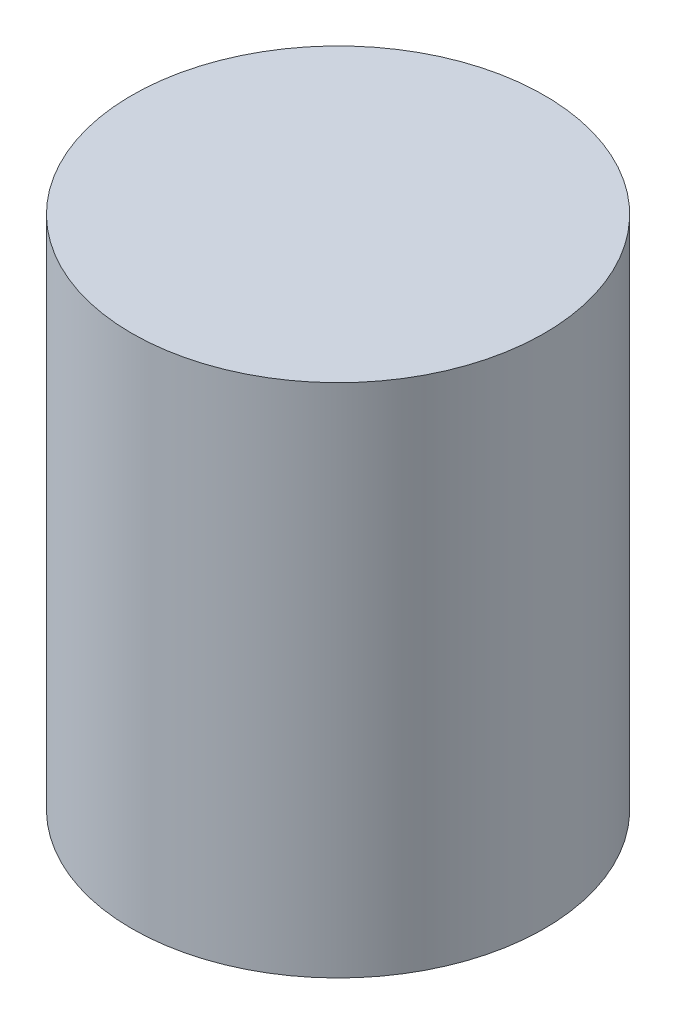
from build123d import *

# Parameters (mm, degrees)
SKETCH1_R           = 200
BOSS_EXTRUDE1_DEPTH = 500


with BuildPart() as part:
    # Sketch1 → Boss-Extrude1 (new body)
    with BuildSketch(Plane(origin=(0, 0, 0), x_dir=(1, 0, 0), z_dir=(0, 1, 0))):
        with Locations(Location((0, 0, 0), (0, 0, 270))):
            Circle(SKETCH1_R)
    extrude(amount=BOSS_EXTRUDE1_DEPTH)


solid = part.part
